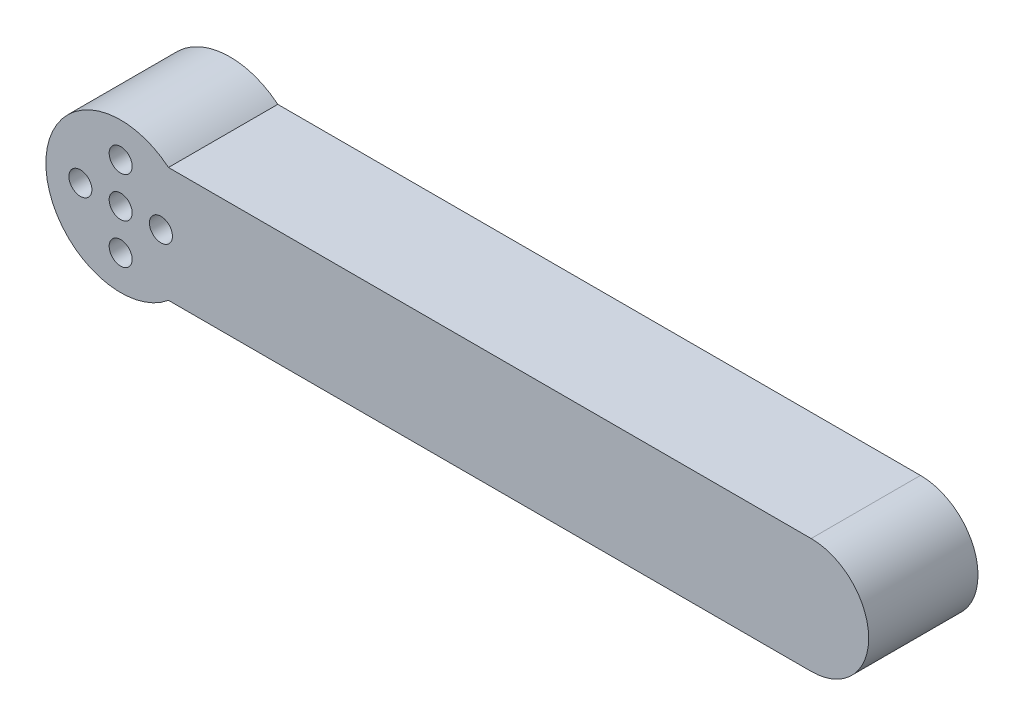
from build123d import *

# Parameters (mm, degrees)
SKETCH1_R               = 13
ELBOW_BOSS_DEPTH        = 19
BAR_DEPTH               = 19
CUT_EXTRUDE1_DEPTH      = 133.022725317
CUT_EXTRUDE1_DEPTH_BACK = 4
SKETCH3_R               = 10.1
SKETCH4_R               = 4.25
CUT_EXTRUDE2_DEPTH      = 2.6
SKETCH5_R               = 2
CUT_EXTRUDE3_DEPTH      = 10
SKETCH6_R               = 2
CUT_EXTRUDE4_DEPTH      = 13
SKETCH7_R               = 1.1
CUT_EXTRUDE5_DEPTH      = 132.506653824
CIRPATTERN1_COUNT       = 4


with BuildPart() as part:
    # Sketch1 → Elbow Boss (new body)
    with BuildSketch(Plane.XY):
        Circle(SKETCH1_R)
    extrude(amount=ELBOW_BOSS_DEPTH)

    # Sketch2 → Bar (add)
    with BuildSketch(Plane.XY):
        with BuildLine():
            Line((0, 10), (120, 10))
            ThreePointArc((120, 10), (130, 0), (120, -10))
            Line((120, -10), (0, -10))
            ThreePointArc((0, -10), (-10, 0), (0, 10))
        make_face()
    extrude(amount=BAR_DEPTH)

    # Sketch3 → Cut-Extrude1 (cut, two sides: drawn at the far end of the back side and taken through both)
    with BuildSketch(Plane(origin=(0, 0, 0), x_dir=(-1, 0, 0), z_dir=(0, 0, -1)).offset(-CUT_EXTRUDE1_DEPTH_BACK)):
        Circle(SKETCH3_R)
    extrude(amount=CUT_EXTRUDE1_DEPTH + CUT_EXTRUDE1_DEPTH_BACK, mode=Mode.SUBTRACT)

    # Sketch4 → Cut-Extrude2 (cut)
    with BuildSketch(Plane(origin=(0, 0, 4), x_dir=(-1, 0, 0), z_dir=(0, 0, -1))):
        Circle(SKETCH4_R)
    extrude(amount=-CUT_EXTRUDE2_DEPTH, mode=Mode.SUBTRACT)

    # Sketch5 → Cut-Extrude3 (cut)
    with BuildSketch(Plane.XY.offset(19)):
        Circle(SKETCH5_R)
    extrude(amount=-CUT_EXTRUDE3_DEPTH, mode=Mode.SUBTRACT)

    # Sketch6 → Cut-Extrude4 (cut)
    with BuildSketch(Plane.XY.offset(19)):
        with Locations((7, 0)):
            Circle(SKETCH6_R)
    cut_extrude4 = extrude(amount=-CUT_EXTRUDE4_DEPTH, mode=Mode.SUBTRACT)

    # Sketch7 → Cut-Extrude5 (cut, through all)
    with BuildSketch(Plane(origin=(0, 0, 4), x_dir=(-1, 0, 0), z_dir=(0, 0, -1))):
        with Locations((-7, 0)):
            Circle(SKETCH7_R)
    cut_extrude5 = extrude(amount=-CUT_EXTRUDE5_DEPTH, mode=Mode.SUBTRACT)

    # CirPattern1: Cut-Extrude4, Cut-Extrude5 ×4 about axis
    cirpattern1_axis = Axis((0, 0, 9), (0, 0, 1))
    add([cut_extrude4.rotate(cirpattern1_axis, i * 360 / CIRPATTERN1_COUNT) for i in range(1, CIRPATTERN1_COUNT)], mode=Mode.SUBTRACT)
    add([cut_extrude5.rotate(cirpattern1_axis, i * 360 / CIRPATTERN1_COUNT) for i in range(1, CIRPATTERN1_COUNT)], mode=Mode.SUBTRACT)


solid = part.part
